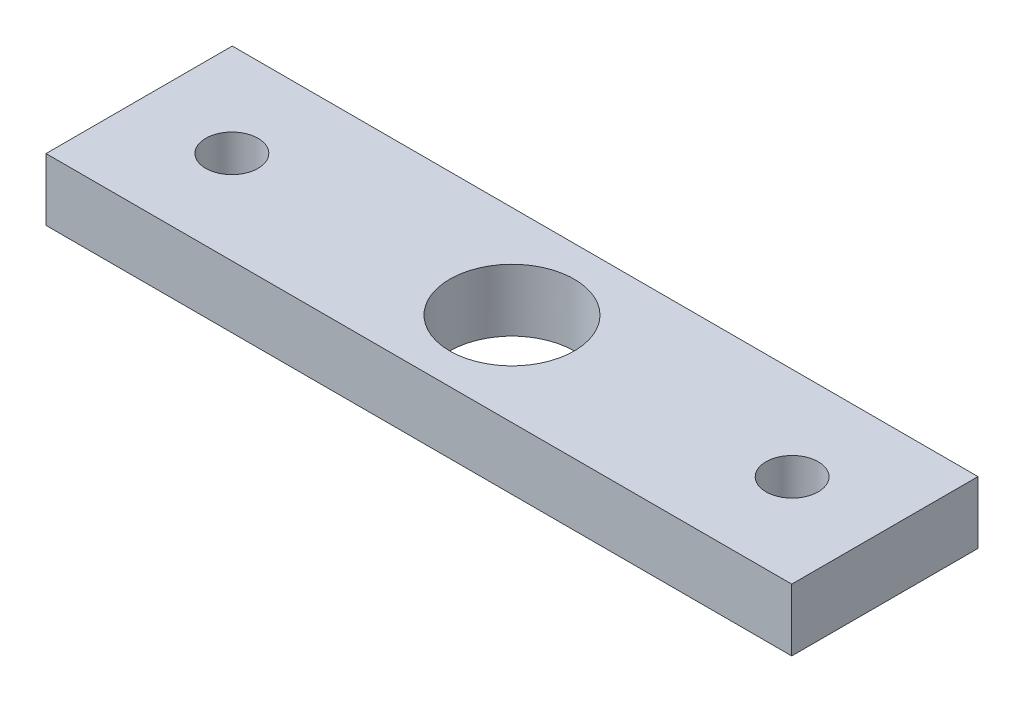
from build123d import *

# Parameters (mm, degrees)
SKETCH1_W           = 76.073
SKETCH1_H           = 19
BOSS_EXTRUDE1_DEPTH = 6.35
CUT_EXTRUDE2_REACH  = 41.716
SKETCH2_R           = 6.35
CUT_EXTRUDE3_REACH  = 41.716
SKETCH4_R           = 2.665


with BuildPart() as part:
    # Sketch1 → Boss-Extrude1 (new body)
    with BuildSketch(Plane(origin=(0, 0, 0), x_dir=(1, 0, 0), z_dir=(0, 1, 0))):
        Rectangle(SKETCH1_W, SKETCH1_H)
    extrude(amount=BOSS_EXTRUDE1_DEPTH)

    # Sketch2 → Cut-Extrude2 (cut, up to next)
    with BuildSketch(Plane(origin=(0, 6.35, 0), x_dir=(1, 0, 0), z_dir=(0, 1, 0)), mode=Mode.PRIVATE) as cut_extrude2_sk1:
        with Locations(Location((0, 0, 0), (0, 0, 270))):
            Circle(SKETCH2_R)
    cut_extrude2_tool1 = extrude(cut_extrude2_sk1.sketch, amount=-CUT_EXTRUDE2_REACH, mode=Mode.PRIVATE) & part.part
    add(cut_extrude2_tool1.solids().sort_by_distance((0, 6.35, 0))[0], mode=Mode.SUBTRACT)

    # Sketch4 → Cut-Extrude3 (cut, up to next)
    with BuildSketch(Plane(origin=(0, 6.35, 0), x_dir=(1, 0, 0), z_dir=(0, 1, 0)), mode=Mode.PRIVATE) as cut_extrude3_sk1:
        with Locations(Location((28.575, 0, 0), (0, 0, 270))):
            Circle(SKETCH4_R)
    cut_extrude3_tool1 = extrude(cut_extrude3_sk1.sketch, amount=-CUT_EXTRUDE3_REACH, mode=Mode.PRIVATE) & part.part
    # Sketch4 → Cut-Extrude3 (cut, up to next)
    with BuildSketch(Plane(origin=(0, 6.35, 0), x_dir=(1, 0, 0), z_dir=(0, 1, 0)), mode=Mode.PRIVATE) as cut_extrude3_sk2:
        with Locations(Location((-28.575, 0, 0), (0, 0, 90))):
            Circle(SKETCH4_R)
    cut_extrude3_tool2 = extrude(cut_extrude3_sk2.sketch, amount=-CUT_EXTRUDE3_REACH, mode=Mode.PRIVATE) & part.part
    add(cut_extrude3_tool1.solids().sort_by_distance((28.575, 6.35, 0))[0], mode=Mode.SUBTRACT)
    add(cut_extrude3_tool2.solids().sort_by_distance((-28.575, 6.35, 0))[0], mode=Mode.SUBTRACT)


solid = part.part
